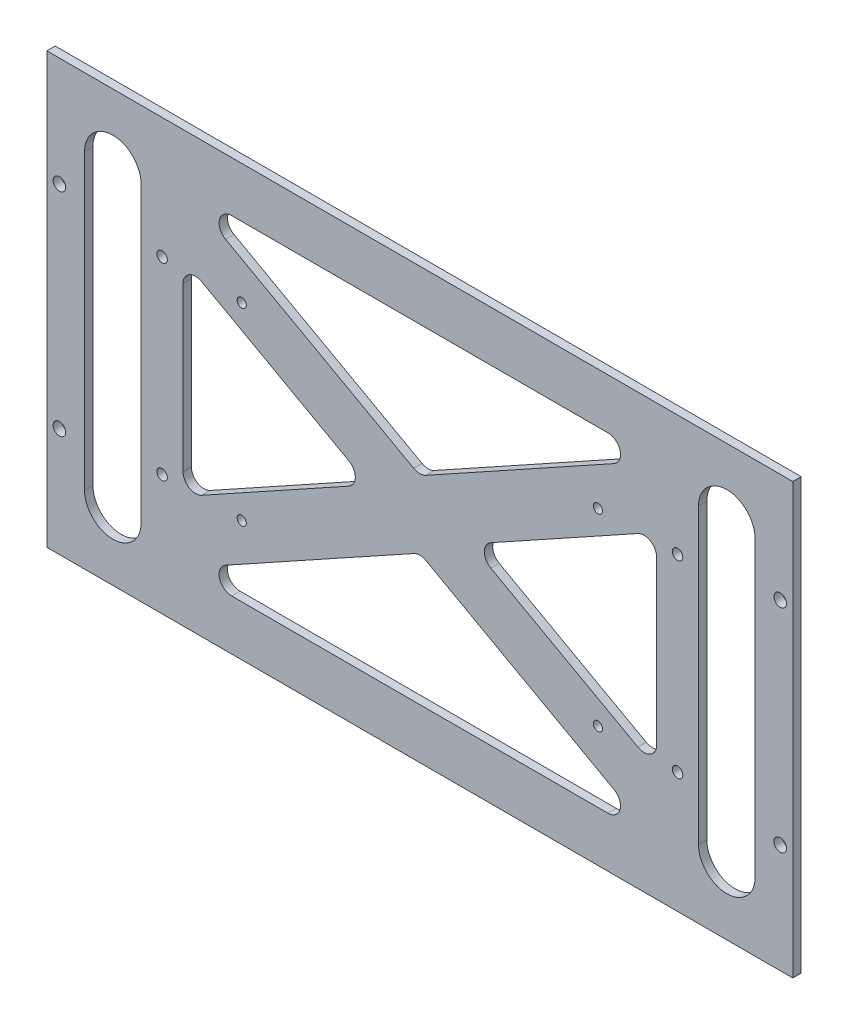
from build123d import *

# Parameters (mm, degrees)
SKETCH_1_W          = 178
SKETCH_1_H          = 102.6
SKETCH_1_R          = 1.5
EXTRUDE_1_DEPTH     = 2
SKETCH_3_R          = 1.25
SKETCH_3_R_2        = 1.1
CUT_EXTRUDE_1_DEPTH = 103.74575417
CUT_EXTRUDE_2_DEPTH = 103.74575417
FILLET_1_R          = 3


with BuildPart() as part:
    # 草图1 → 凸台-拉伸1 (new body)
    with BuildSketch(Plane.XY):
        Rectangle(SKETCH_1_W, SKETCH_1_H)
        with Locations((-86, 25.3)):
            Circle(SKETCH_1_R, mode=Mode.SUBTRACT)
        with Locations((-86, -25.3)):
            Circle(SKETCH_1_R, mode=Mode.SUBTRACT)
        with Locations((86, 25.3)):
            Circle(SKETCH_1_R, mode=Mode.SUBTRACT)
        with Locations((86, -25.3)):
            Circle(SKETCH_1_R, mode=Mode.SUBTRACT)
    extrude(amount=EXTRUDE_1_DEPTH)

    # 草图3 → 切除-拉伸1 (cut, through all)
    with BuildSketch(Plane.XY.offset(2)):
        with Locations((-61.5, -22.5)):
            Circle(SKETCH_3_R)
        with Locations((-61.5, 22.5)):
            Circle(SKETCH_3_R)
        with Locations((61.5, -22.5)):
            Circle(SKETCH_3_R)
        with Locations((61.5, 22.5)):
            Circle(SKETCH_3_R)
        with Locations((-42.5, -22.5)):
            Circle(SKETCH_3_R_2)
        with Locations((-42.5, 22.5)):
            Circle(SKETCH_3_R_2)
        with Locations((42.5, 22.5)):
            Circle(SKETCH_3_R_2)
        with Locations((42.5, -22.5)):
            Circle(SKETCH_3_R_2)
    extrude(amount=-CUT_EXTRUDE_1_DEPTH, mode=Mode.SUBTRACT)

    # 草图4 → 切除-拉伸2 (cut, through all)
    with BuildSketch(Plane.XY.offset(2)):
        with BuildLine():
            Line((-80, -35), (-80, 35))
            ThreePointArc((-80, 35), (-73.25, 41.75), (-66.5, 35))
            Line((-66.5, 35), (-66.5, -35))
            ThreePointArc((-66.5, -35), (-73.25, -41.75), (-80, -35))
        make_face()
        with BuildLine():
            Line((80, -35), (80, 35))
            ThreePointArc((80, 35), (73.25, 41.75), (66.5, 35))
            Line((66.5, 35), (66.5, -35))
            ThreePointArc((66.5, -35), (73.25, -41.75), (80, -35))
        make_face()
        Polygon((-56.5, -24.539773754), (-56.5, 24.539773754), (-12.202964311, 0), align=None)
        Polygon((-56.5, 39.3), (0, 8), (56.5, 39.3), align=None)
        Polygon((56.5, -39.3), (-56.5, -39.3), (0, -8), align=None)
        Polygon((12.202964311, 0), (56.5, -24.539773754), (56.5, 24.539773754), align=None)
    extrude(amount=-CUT_EXTRUDE_2_DEPTH, mode=Mode.SUBTRACT)

    # 圆角1
    fillet_1_edges = [part.edges().sort_by_distance(p)[0] for p in [
        (12.202964311, 0, 1),
        (56.5, 24.539773754, 1),
        (56.5, -24.539773754, 1),
        (56.5, 39.3, 1),
        (0, 8, 1),
        (-56.5, 39.3, 1),
        (-12.202964311, 0, 1),
        (-56.5, -24.539773754, 1),
        (-56.5, 24.539773754, 1),
        (-56.5, -39.3, 1),
        (0, -8, 1),
        (56.5, -39.3, 1),
    ]]
    fillet(fillet_1_edges, radius=FILLET_1_R)


solid = part.part
